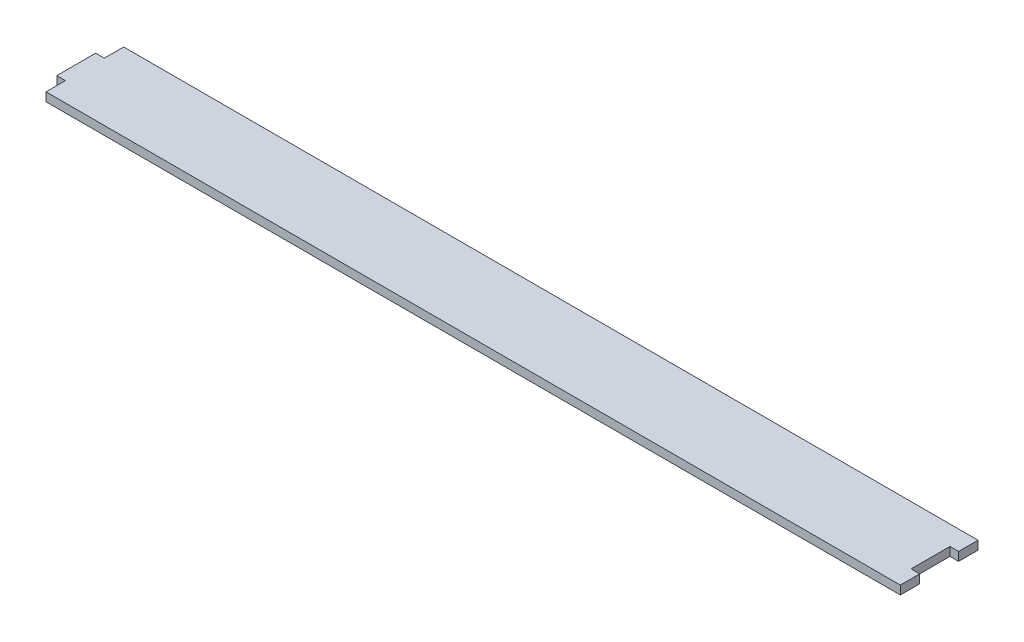
from build123d import *

# Parameters (mm, degrees)
BOSS_EXTRUDE1_DEPTH = 4


with BuildPart() as part:
    # Sketch2 → Boss-Extrude1 (new body)
    with BuildSketch(Plane(origin=(0, 0, 0), x_dir=(1, 0, 0), z_dir=(0, 1, 0))):
        Polygon((4, 27), (4, 36), (400, 36), (400, 27), (396, 27), (396, 9), (400, 9), (400, 0), (4, 0), (4, 9), (0, 9), (0, 27), align=None)
    extrude(amount=BOSS_EXTRUDE1_DEPTH)


solid = part.part
